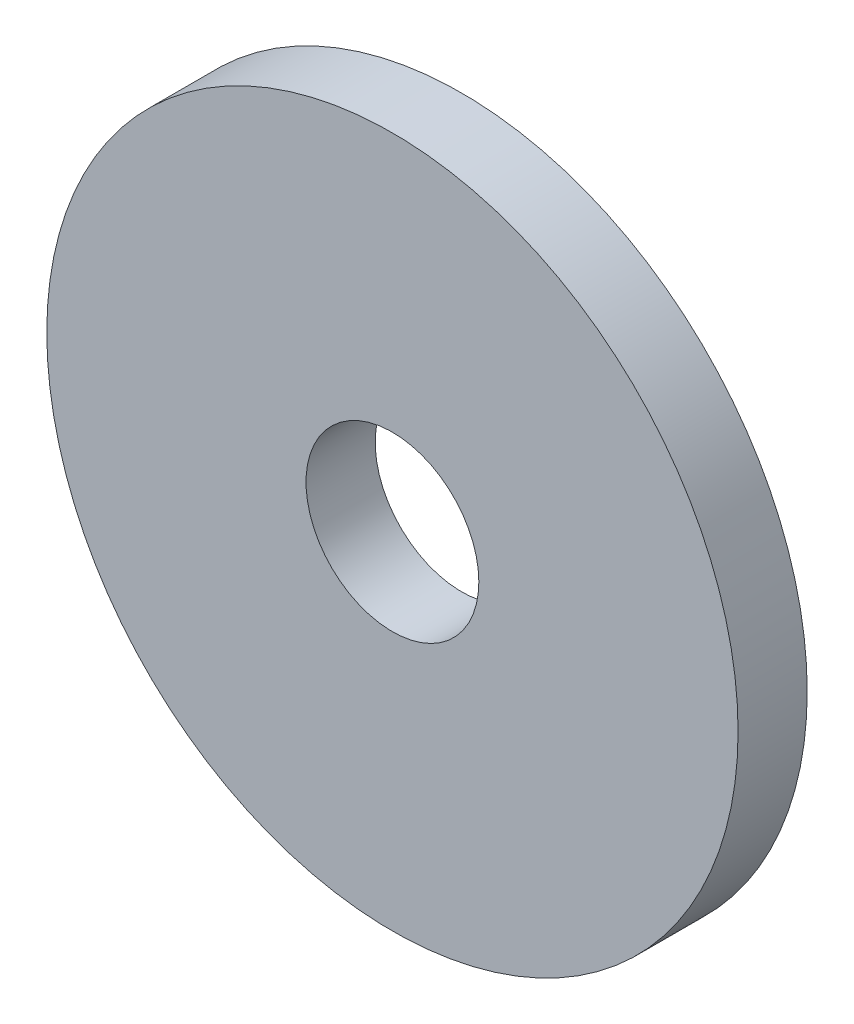
from build123d import *

# Parameters (mm, degrees)
SKETCH_1_R          = 10
EXTRUDE_1_DEPTH     = 2
SKETCH_2_R          = 2.5
CUT_EXTRUDE_1_DEPTH = 15.282856857


with BuildPart() as part:
    # 草图1 → 凸台-拉伸1 (new body)
    with BuildSketch(Plane.XY):
        Circle(SKETCH_1_R)
    extrude(amount=EXTRUDE_1_DEPTH)

    # 草图2 → 切除-拉伸1 (cut, through all)
    with BuildSketch(Plane.XY.offset(2)):
        Circle(SKETCH_2_R)
    extrude(amount=-CUT_EXTRUDE_1_DEPTH, mode=Mode.SUBTRACT)


solid = part.part
